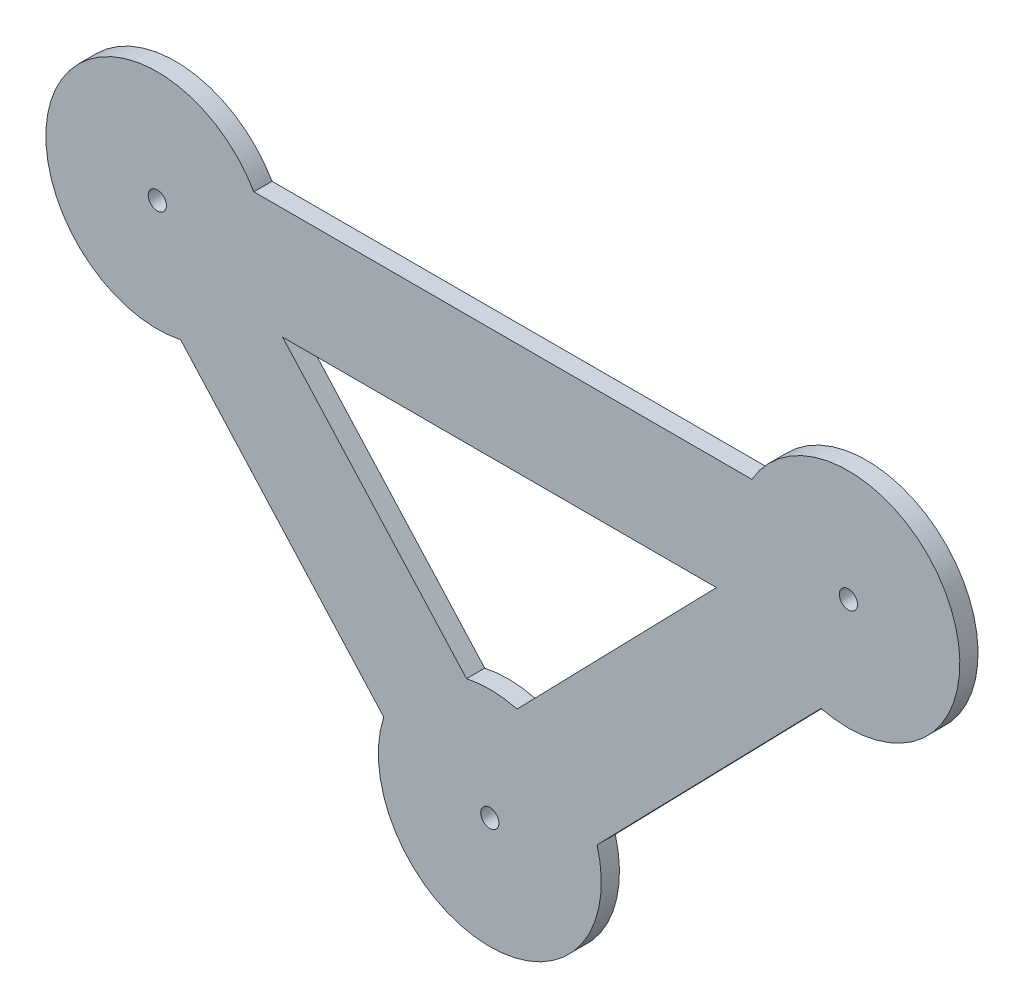
from build123d import *

# Parameters (mm, degrees)
BOSS_EXTRUDE1_DEPTH = 6.223


with BuildPart() as part:
    # Sketch1 → Boss-Extrude1 (new body)
    with BuildSketch(Plane.XY):
        with BuildLine():
            ThreePointArc((32.995567884, 38.1), (-34.813454061, 34.530097426), (7.956908754, -18.209865849))
            Line((7.956908754, -18.209865849), (-14.14476943, 6.28959257))
            Line((-14.14476943, 6.28959257), (-2.310313541, 16.965801451))
            ThreePointArc((-2.310313541, 16.965801451), (-2.843098313, 20.314208935), (0, 22.1615))
            Line((0, 22.1615), (0, 38.1))
            Line((0, 38.1), (32.995567884, 38.1))
        make_face()
        with BuildLine():
            Line((14.14476656, 31.810410611), (36.246444744, 7.310952192))
            ThreePointArc((36.246444744, 7.310952192), (37.633758414, 13.10775904), (38.1, 19.05))
            ThreePointArc((38.1, 19.05), (36.801773982, 28.911005618), (32.995567884, 38.1))
            Line((32.995567884, 38.1), (0, 38.1))
            Line((0, 38.1), (0, 22.1615))
            ThreePointArc((0, 22.1615), (1.264206978, 21.893099184), (2.310310671, 21.134201731))
            Line((2.310310671, 21.134201731), (14.14476656, 31.810410611))
        make_face()
        with BuildLine():
            Line((0, 15.9385), (0, 0))
            Line((0, 0), (32.995567884, 0))
            ThreePointArc((32.995567884, 0), (34.813454061, 3.569902574), (36.246444744, 7.310952192))
            Line((36.246444744, 7.310952192), (14.14476656, 31.810410611))
            Line((14.14476656, 31.810410611), (2.310310671, 21.134201731))
            ThreePointArc((2.310310671, 21.134201731), (2.904304039, 20.166445385), (3.1115, 19.05))
            ThreePointArc((3.1115, 19.05), (2.20016275, 16.84983725), (0, 15.9385))
        make_face()
        with BuildLine():
            Line((32.995567884, 0), (0, 0))
            Line((0, 0), (0, 15.9385))
            ThreePointArc((0, 15.9385), (-1.264208935, 16.206901687), (-2.310313541, 16.965801451))
            Line((-2.310313541, 16.965801451), (-14.14476943, 6.28959257))
            Line((-14.14476943, 6.28959257), (7.956908754, -18.209865849))
            ThreePointArc((7.956908754, -18.209865849), (22.409286898, -11.762884655), (32.995567884, 0))
        make_face()
        with BuildLine():
            Line((36.246444744, 7.310952192), (42.841868602, 0))
            Line((42.841868602, 0), (191.108363525, 0))
            Line((191.108363525, 0), (199.557192075, 8.684262446))
            ThreePointArc((199.557192075, 8.684262446), (198.412676185, 23.763413406), (203.224432116, 38.1))
            Line((203.224432116, 38.1), (32.995567884, 38.1))
            ThreePointArc((32.995567884, 38.1), (36.801773982, 28.911005618), (38.1, 19.05))
            ThreePointArc((38.1, 19.05), (37.633758414, 13.10775904), (36.246444744, 7.310952192))
        make_face()
        with BuildLine():
            ThreePointArc((36.246444744, 7.310952192), (34.813454061, 3.569902574), (32.995567884, 0))
            Line((32.995567884, 0), (42.841868602, 0))
            Line((42.841868602, 0), (36.246444744, 7.310952192))
        make_face()
        with BuildLine():
            Line((42.841868602, 0), (32.995567884, 0))
            ThreePointArc((32.995567884, 0), (22.409286898, -11.762884655), (7.956908754, -18.209865849))
            Line((7.956908754, -18.209865849), (77.406264934, -95.193685799))
            ThreePointArc((77.406264934, -95.193685799), (88.131891636, -78.643197617), (105.695800923, -69.672867758))
            Line((105.695800923, -69.672867758), (42.841868602, 0))
        make_face()
        with BuildLine():
            ThreePointArc((203.224432116, 38.1), (198.412676185, 23.763413406), (199.557192075, 8.684262446))
            Line((199.557192075, 8.684262446), (222.565801994, 32.33402713))
            Line((222.565801994, 32.33402713), (233.989814326, 21.219724431))
            ThreePointArc((233.989814326, 21.219724431), (235.00955903, 21.916402782), (236.22, 22.1615))
            Line((236.22, 22.1615), (236.22, 38.1))
            Line((236.22, 38.1), (203.224432116, 38.1))
        make_face()
        with BuildLine():
            Line((199.557192075, 8.684262446), (191.108363525, 0))
            Line((191.108363525, 0), (203.224432116, 0))
            ThreePointArc((203.224432116, 0), (201.121190424, 4.228273841), (199.557192075, 8.684262446))
        make_face()
        with BuildLine():
            ThreePointArc((199.557192075, 8.684262446), (201.121190424, 4.228273841), (203.224432116, 0))
            Line((203.224432116, 0), (236.22, 0))
            Line((236.22, 0), (236.22, 15.9385))
            ThreePointArc((236.22, 15.9385), (233.353597218, 17.83955903), (233.989814326, 21.219724431))
            Line((233.989814326, 21.219724431), (222.565801994, 32.33402713))
            Line((222.565801994, 32.33402713), (199.557192075, 8.684262446))
        make_face()
        with BuildLine():
            ThreePointArc((274.32, 19.05), (246.081005618, 55.851773982), (203.224432116, 38.1))
            Line((203.224432116, 38.1), (236.22, 38.1))
            Line((236.22, 38.1), (236.22, 22.1615))
            ThreePointArc((236.22, 22.1615), (238.42016275, 21.25016275), (239.3315, 19.05))
            ThreePointArc((239.3315, 19.05), (239.102763863, 17.879058173), (238.450185674, 16.880275569))
            Line((238.450185674, 16.880275569), (249.874198006, 5.76597287))
            Line((249.874198006, 5.76597287), (226.865588088, -17.883791814))
            ThreePointArc((226.865588088, -17.883791814), (259.620928466, -11.01670163), (274.32, 19.05))
        make_face()
        with BuildLine():
            Line((236.22, 0), (203.224432116, 0))
            ThreePointArc((203.224432116, 0), (213.234402344, -11.33539617), (226.865588088, -17.883791814))
            Line((226.865588088, -17.883791814), (249.874198006, 5.76597287))
            Line((249.874198006, 5.76597287), (238.450185674, 16.880275569))
            ThreePointArc((238.450185674, 16.880275569), (237.43044097, 16.183597218), (236.22, 15.9385))
            Line((236.22, 15.9385), (236.22, 0))
        make_face()
        with BuildLine():
            Line((203.224432116, 0), (191.108363525, 0))
            Line((191.108363525, 0), (123.00712159, -69.998941792))
            ThreePointArc((123.00712159, -69.998941792), (140.220763938, -79.624337594), (150.315517603, -96.566996053))
            Line((150.315517603, -96.566996053), (226.865588088, -17.883791814))
            ThreePointArc((226.865588088, -17.883791814), (213.234402344, -11.33539617), (203.224432116, 0))
        make_face()
        with BuildLine():
            ThreePointArc((123.00712159, -69.998941792), (114.370229599, -68.839490568), (105.695800923, -69.672867758))
            Line((105.695800923, -69.672867758), (114.17744096, -79.07466909))
            Line((114.17744096, -79.07466909), (123.00712159, -69.998941792))
        make_face()
        with BuildLine():
            Line((114.17744096, -79.07466909), (105.695800923, -69.672867758))
            ThreePointArc((105.695800923, -69.672867758), (88.131891636, -78.643197617), (77.406264934, -95.193685799))
            Line((77.406264934, -95.193685799), (99.507943118, -119.693144218))
            Line((99.507943118, -119.693144218), (111.342399007, -109.016935337))
            ThreePointArc((111.342399007, -109.016935337), (110.541761476, -106.874137217), (111.422524003, -104.763009175))
            Line((111.422524003, -104.763009175), (99.998511671, -93.648706476))
            Line((99.998511671, -93.648706476), (114.17744096, -79.07466909))
        make_face()
        with BuildLine():
            Line((127.797479107, -94.172326176), (114.17744096, -79.07466909))
            Line((114.17744096, -79.07466909), (99.998511671, -93.648706476))
            Line((99.998511671, -93.648706476), (111.422524003, -104.763009175))
            ThreePointArc((111.422524003, -104.763009175), (113.711308209, -103.821785445), (115.963023218, -104.848535057))
            Line((115.963023218, -104.848535057), (127.797479107, -94.172326176))
        make_face()
        with BuildLine():
            ThreePointArc((150.315517603, -96.566996053), (140.220763938, -79.624337594), (123.00712159, -69.998941792))
            Line((123.00712159, -69.998941792), (114.17744096, -79.07466909))
            Line((114.17744096, -79.07466909), (127.797479107, -94.172326176))
            Line((127.797479107, -94.172326176), (115.963023218, -104.848535057))
            ThreePointArc((115.963023218, -104.848535057), (116.557014485, -105.816290221), (116.764209677, -106.932733607))
            ThreePointArc((116.764209677, -106.932733607), (116.53547354, -108.103675433), (115.882895352, -109.102458038))
            Line((115.882895352, -109.102458038), (127.306907684, -120.216760737))
            Line((127.306907684, -120.216760737), (150.315517603, -96.566996053))
        make_face()
        with BuildLine():
            Line((99.507943118, -119.693144218), (77.406264934, -95.193685799))
            ThreePointArc((77.406264934, -95.193685799), (107.710468717, -144.566492021), (151.752709677, -106.932733607))
            ThreePointArc((151.752709677, -106.932733607), (151.39170133, -101.700285898), (150.315517603, -96.566996053))
            Line((150.315517603, -96.566996053), (127.306907684, -120.216760737))
            Line((127.306907684, -120.216760737), (115.882895352, -109.102458038))
            ThreePointArc((115.882895352, -109.102458038), (113.594113288, -110.043681808), (111.342399007, -109.016935337))
            Line((111.342399007, -109.016935337), (99.507943118, -119.693144218))
        make_face()
    extrude(amount=-BOSS_EXTRUDE1_DEPTH)


solid = part.part
